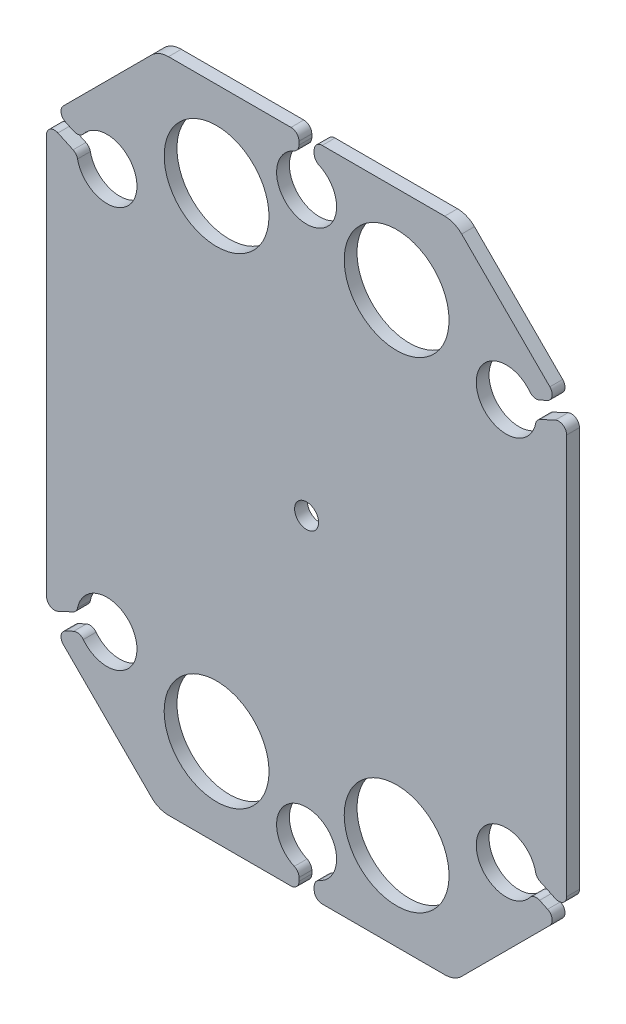
from build123d import *

# Parameters (mm, degrees)
IZIM1_R                     = 6.55
Y_KSEKLIK_EKSTR_ZYON1_DEPTH = 1.6
IZIM2_R                     = 1.5
KES_EKSTR_ZYON1_DEPTH       = 1.6


with BuildPart() as part:
    # Çizim1 → Yükseklik-Ekstrüzyon1 (new body)
    with BuildSketch(Plane.XY):
        with BuildLine():
            Line((51.878679656, -0.878679656), (62.901413512, -11.901413512))
            ThreePointArc((62.901413512, -11.901413512), (63.179114484, -12.782168471), (62.616924992, -13.51482808))
            Line((62.616924992, -13.51482808), (61.615557944, -13.981773203))
            ThreePointArc((61.615557944, -13.981773203), (60.959512838, -14.047839782), (60.404952381, -13.691156907))
            ThreePointArc((60.404952381, -13.691156907), (53.799180994, -16.856750014), (61.123557768, -16.753308252))
            ThreePointArc((61.123557768, -16.753308252), (61.318334892, -16.334489822), (61.680554911, -16.047882666))
            Line((61.680554911, -16.047882666), (63.577381738, -15.16337779))
            ThreePointArc((63.577381738, -15.16337779), (64.537299608, -15.226294131), (65, -16.069685577))
            Line((65, -16.069685577), (65, -66.030314423))
            ThreePointArc((65, -66.030314423), (64.537299608, -66.873705869), (63.577381738, -66.93662221))
            Line((63.577381738, -66.93662221), (61.680554911, -66.052117334))
            ThreePointArc((61.680554911, -66.052117334), (61.318334892, -65.765510178), (61.123557768, -65.346691748))
            ThreePointArc((61.123557768, -65.346691748), (53.799180994, -65.243249986), (60.404952381, -68.408843093))
            ThreePointArc((60.404952381, -68.408843093), (60.959512838, -68.052160218), (61.615557944, -68.118226797))
            Line((61.615557944, -68.118226797), (62.616924992, -68.58517192))
            ThreePointArc((62.616924992, -68.58517192), (63.179114484, -69.317831529), (62.901413512, -70.198586488))
            Line((62.901413512, -70.198586488), (51.878679656, -81.221320344))
            ThreePointArc((51.878679656, -81.221320344), (50.90540961, -81.871638598), (49.757359313, -82.1))
            Line((49.757359313, -82.1), (34.45, -82.1))
            ThreePointArc((34.45, -82.1), (33.742893219, -81.807106781), (33.45, -81.1))
            Line((33.45, -81.1), (33.45, -80.681281566))
            ThreePointArc((33.45, -80.681281566), (33.610200525, -80.138384852), (34.039473684, -79.769432815))
            ThreePointArc((34.039473684, -79.769432815), (32.5, -72.6), (30.960526316, -79.769432815))
            ThreePointArc((30.960526316, -79.769432815), (31.389799475, -80.138384852), (31.55, -80.681281566))
            Line((31.55, -80.681281566), (31.55, -81.1))
            ThreePointArc((31.55, -81.1), (31.257106781, -81.807106781), (30.55, -82.1))
            Line((30.55, -82.1), (15.242640687, -82.1))
            ThreePointArc((15.242640687, -82.1), (14.09459039, -81.871638598), (13.121320344, -81.221320344))
            Line((13.121320344, -81.221320344), (2.098586488, -70.198586488))
            ThreePointArc((2.098586488, -70.198586488), (1.820885516, -69.317831529), (2.383075008, -68.58517192))
            Line((2.383075008, -68.58517192), (3.384442056, -68.118226797))
            ThreePointArc((3.384442056, -68.118226797), (4.040487162, -68.052160218), (4.595047619, -68.408843093))
            ThreePointArc((4.595047619, -68.408843093), (11.200819006, -65.243249986), (3.876442232, -65.346691748))
            ThreePointArc((3.876442232, -65.346691748), (3.681665108, -65.765510178), (3.319445089, -66.052117334))
            Line((3.319445089, -66.052117334), (1.422618262, -66.93662221))
            ThreePointArc((1.422618262, -66.93662221), (0.462700392, -66.873705869), (0, -66.030314423))
            Line((0, -66.030314423), (0, -16.069685577))
            ThreePointArc((0, -16.069685577), (0.462700392, -15.226294131), (1.422618262, -15.16337779))
            Line((1.422618262, -15.16337779), (3.319445089, -16.047882666))
            ThreePointArc((3.319445089, -16.047882666), (3.681665108, -16.334489822), (3.876442232, -16.753308252))
            ThreePointArc((3.876442232, -16.753308252), (11.200819006, -16.856750014), (4.595047619, -13.691156907))
            ThreePointArc((4.595047619, -13.691156907), (4.040487162, -14.047839782), (3.384442056, -13.981773203))
            Line((3.384442056, -13.981773203), (2.383075008, -13.51482808))
            ThreePointArc((2.383075008, -13.51482808), (1.820885516, -12.782168471), (2.098586488, -11.901413512))
            Line((2.098586488, -11.901413512), (13.121320344, -0.878679656))
            ThreePointArc((13.121320344, -0.878679656), (14.09459039, -0.228361402), (15.242640687, 0))
            Line((15.242640687, 0), (30.55, 0))
            ThreePointArc((30.55, 0), (31.257106781, -0.292893219), (31.55, -1))
            Line((31.55, -1), (31.55, -1.418718434))
            ThreePointArc((31.55, -1.418718434), (31.389799475, -1.961615148), (30.960526316, -2.330567185))
            ThreePointArc((30.960526316, -2.330567185), (32.5, -9.5), (34.039473684, -2.330567185))
            ThreePointArc((34.039473684, -2.330567185), (33.610200525, -1.961615148), (33.45, -1.418718434))
            Line((33.45, -1.418718434), (33.45, -1))
            ThreePointArc((33.45, -1), (33.742893219, -0.292893219), (34.45, 0))
            Line((34.45, 0), (49.757359313, 0))
            ThreePointArc((49.757359313, 0), (50.90540961, -0.228361402), (51.878679656, -0.878679656))
        make_face()
        with Locations((21.25, -11)):
            Circle(IZIM1_R, mode=Mode.SUBTRACT)
        with Locations((43.75, -11)):
            Circle(IZIM1_R, mode=Mode.SUBTRACT)
        with Locations(Location((43.75, -71.1, 0), (0, 0, 180))):
            Circle(IZIM1_R, mode=Mode.SUBTRACT)
        with Locations(Location((21.25, -71.1, 0), (0, 0, 180))):
            Circle(IZIM1_R, mode=Mode.SUBTRACT)
    extrude(amount=Y_KSEKLIK_EKSTR_ZYON1_DEPTH)

    # Çizim2 → Kes-Ekstrüzyon1 (cut)
    with BuildSketch(Plane.XY.offset(1.6)):
        with Locations((32.5, -41.05)):
            Circle(IZIM2_R)
    extrude(amount=-KES_EKSTR_ZYON1_DEPTH, mode=Mode.SUBTRACT)


solid = part.part
